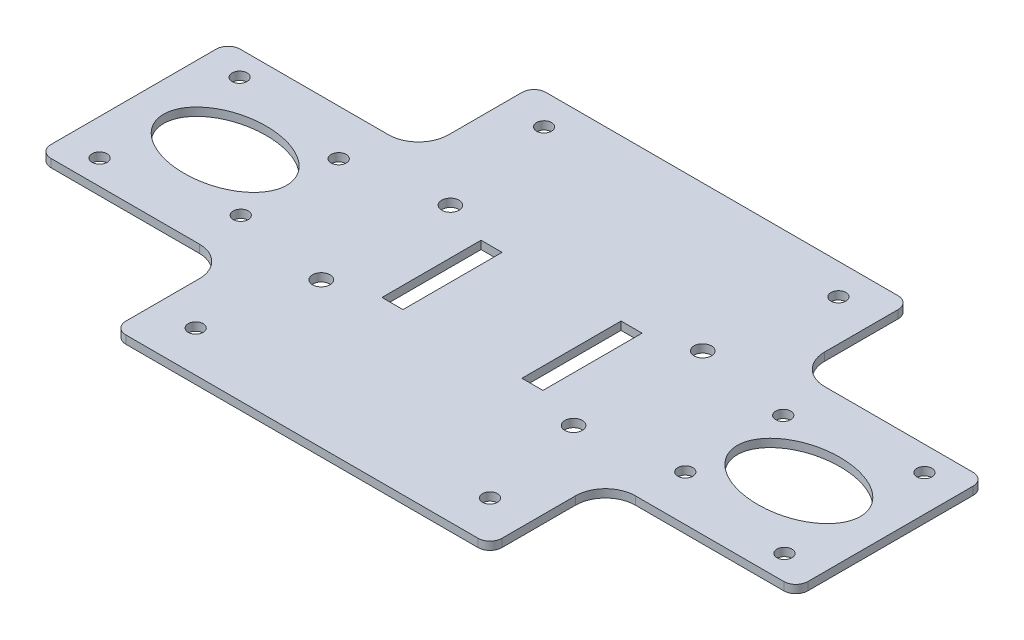
from build123d import *

# Parameters (mm, degrees)
SKETCH2_R           = 1.45
SKETCH2_R_2         = 1.25
BOSS_EXTRUDE1_DEPTH = 1.35
CUT_EXTRUDE1_REACH  = 74.065
SKETCH5_RX          = 10.25
SKETCH5_RY          = 6.825
SKETCH5_W           = 3.5
SKETCH5_H           = 16.5


with BuildPart() as part:
    # Sketch2 → Boss-Extrude1 (new body)
    with BuildSketch(Plane(origin=(0, 0, 0), x_dir=(1, 0, 0), z_dir=(0, 1, 0))):
        with BuildLine():
            Line((-29.305, -34.965), (29.305, -34.965))
            ThreePointArc((29.305, -34.965), (30.719213562, -34.379213562), (31.305, -32.965))
            Line((31.305, -32.965), (31.305, -20.75))
            ThreePointArc((31.305, -20.75), (32.769466094, -17.214466094), (36.305, -15.75))
            Line((36.305, -15.75), (61, -15.75))
            ThreePointArc((61, -15.75), (62.414213562, -15.164213562), (63, -13.75))
            Line((63, -13.75), (63, 13.75))
            ThreePointArc((63, 13.75), (62.414213562, 15.164213562), (61, 15.75))
            Line((61, 15.75), (36.305, 15.75))
            ThreePointArc((36.305, 15.75), (32.769466094, 17.214466094), (31.305, 20.75))
            Line((31.305, 20.75), (31.305, 32.965))
            ThreePointArc((31.305, 32.965), (30.719213562, 34.379213562), (29.305, 34.965))
            Line((29.305, 34.965), (-29.305, 34.965))
            ThreePointArc((-29.305, 34.965), (-30.719213562, 34.379213562), (-31.305, 32.965))
            Line((-31.305, 32.965), (-31.305, 20.75))
            ThreePointArc((-31.305, 20.75), (-32.769466094, 17.214466094), (-36.305, 15.75))
            Line((-36.305, 15.75), (-61, 15.75))
            ThreePointArc((-61, 15.75), (-62.414213562, 15.164213562), (-63, 13.75))
            Line((-63, 13.75), (-63, -13.75))
            ThreePointArc((-63, -13.75), (-62.414213562, -15.164213562), (-61, -15.75))
            Line((-61, -15.75), (-36.305, -15.75))
            ThreePointArc((-36.305, -15.75), (-32.769466094, -17.214466094), (-31.305, -20.75))
            Line((-31.305, -20.75), (-31.305, -32.965))
            ThreePointArc((-31.305, -32.965), (-30.719213562, -34.379213562), (-29.305, -34.965))
        make_face()
        with Locations(Location((21, -10.75, 0), (0, 0, 270))):
            Circle(SKETCH2_R, mode=Mode.SUBTRACT)
        with Locations(Location((21, 10.75, 0), (0, 0, 270))):
            Circle(SKETCH2_R, mode=Mode.SUBTRACT)
        with Locations(Location((-21, 10.75, 0), (0, 0, 270))):
            Circle(SKETCH2_R, mode=Mode.SUBTRACT)
        with Locations(Location((-24.5, 29.84, 0), (0, 0, 270))):
            Circle(SKETCH2_R_2, mode=Mode.SUBTRACT)
        with Locations(Location((-21, -10.75, 0), (0, 0, 270))):
            Circle(SKETCH2_R, mode=Mode.SUBTRACT)
        with Locations(Location((-24.5, -28.16, 0), (0, 0, 270))):
            Circle(SKETCH2_R_2, mode=Mode.SUBTRACT)
        with Locations(Location((-57, -11.65, 0), (0, 0, 270))):
            Circle(SKETCH2_R_2, mode=Mode.SUBTRACT)
        with Locations(Location((24.5, -28.16, 0), (0, 0, 270))):
            Circle(SKETCH2_R_2, mode=Mode.SUBTRACT)
        with Locations(Location((-57, 11.65, 0), (0, 0, 270))):
            Circle(SKETCH2_R_2, mode=Mode.SUBTRACT)
        with Locations(Location((24.5, 29.84, 0), (0, 0, 270))):
            Circle(SKETCH2_R_2, mode=Mode.SUBTRACT)
        with Locations(Location((57, 11.65, 0), (0, 0, 270))):
            Circle(SKETCH2_R_2, mode=Mode.SUBTRACT)
        with Locations(Location((-37, 8.15, 0), (0, 0, 270))):
            Circle(SKETCH2_R_2, mode=Mode.SUBTRACT)
        with Locations(Location((-37, -8.15, 0), (0, 0, 270))):
            Circle(SKETCH2_R_2, mode=Mode.SUBTRACT)
        with Locations(Location((37, -8.15, 0), (0, 0, 270))):
            Circle(SKETCH2_R_2, mode=Mode.SUBTRACT)
        with Locations(Location((37, 8.15, 0), (0, 0, 270))):
            Circle(SKETCH2_R_2, mode=Mode.SUBTRACT)
        with Locations(Location((57, -11.65, 0), (0, 0, 270))):
            Circle(SKETCH2_R_2, mode=Mode.SUBTRACT)
    extrude(amount=-BOSS_EXTRUDE1_DEPTH)

    # Sketch5 → Cut-Extrude1 (cut, up to next)
    with BuildSketch(Plane(origin=(0, 0, 0), x_dir=(1, 0, 0), z_dir=(0, 1, 0)), mode=Mode.PRIVATE) as cut_extrude1_sk1:
        with Locations(Location((47.75, 0), (0, 0, 180))):
            Ellipse(SKETCH5_RX, SKETCH5_RY)
    cut_extrude1_tool1 = extrude(cut_extrude1_sk1.sketch, amount=-CUT_EXTRUDE1_REACH, mode=Mode.PRIVATE) & part.part
    # Sketch5 → Cut-Extrude1 (cut, up to next)
    with BuildSketch(Plane(origin=(0, 0, 0), x_dir=(1, 0, 0), z_dir=(0, 1, 0)), mode=Mode.PRIVATE) as cut_extrude1_sk2:
        with Locations(Location((-47.75, 0), (0, 0, 0))):
            Ellipse(SKETCH5_RX, SKETCH5_RY)
    cut_extrude1_tool2 = extrude(cut_extrude1_sk2.sketch, amount=-CUT_EXTRUDE1_REACH, mode=Mode.PRIVATE) & part.part
    # Sketch5 → Cut-Extrude1 (cut, up to next)
    with BuildSketch(Plane(origin=(0, 0, 0), x_dir=(1, 0, 0), z_dir=(0, 1, 0)), mode=Mode.PRIVATE) as cut_extrude1_sk3:
        with Locations((11.65, 0)):
            Rectangle(SKETCH5_W, SKETCH5_H)
    cut_extrude1_tool3 = extrude(cut_extrude1_sk3.sketch, amount=-CUT_EXTRUDE1_REACH, mode=Mode.PRIVATE) & part.part
    # Sketch5 → Cut-Extrude1 (cut, up to next)
    with BuildSketch(Plane(origin=(0, 0, 0), x_dir=(1, 0, 0), z_dir=(0, 1, 0)), mode=Mode.PRIVATE) as cut_extrude1_sk4:
        with Locations((-11.65, 0)):
            Rectangle(SKETCH5_W, SKETCH5_H)
    cut_extrude1_tool4 = extrude(cut_extrude1_sk4.sketch, amount=-CUT_EXTRUDE1_REACH, mode=Mode.PRIVATE) & part.part
    add(cut_extrude1_tool1.solids().sort_by_distance((47.75, 0, 0))[0], mode=Mode.SUBTRACT)
    add(cut_extrude1_tool2.solids().sort_by_distance((-47.75, 0, 0))[0], mode=Mode.SUBTRACT)
    add(cut_extrude1_tool3.solids().sort_by_distance((11.65, 0, 0))[0], mode=Mode.SUBTRACT)
    add(cut_extrude1_tool4.solids().sort_by_distance((-11.65, 0, 0))[0], mode=Mode.SUBTRACT)


solid = part.part
